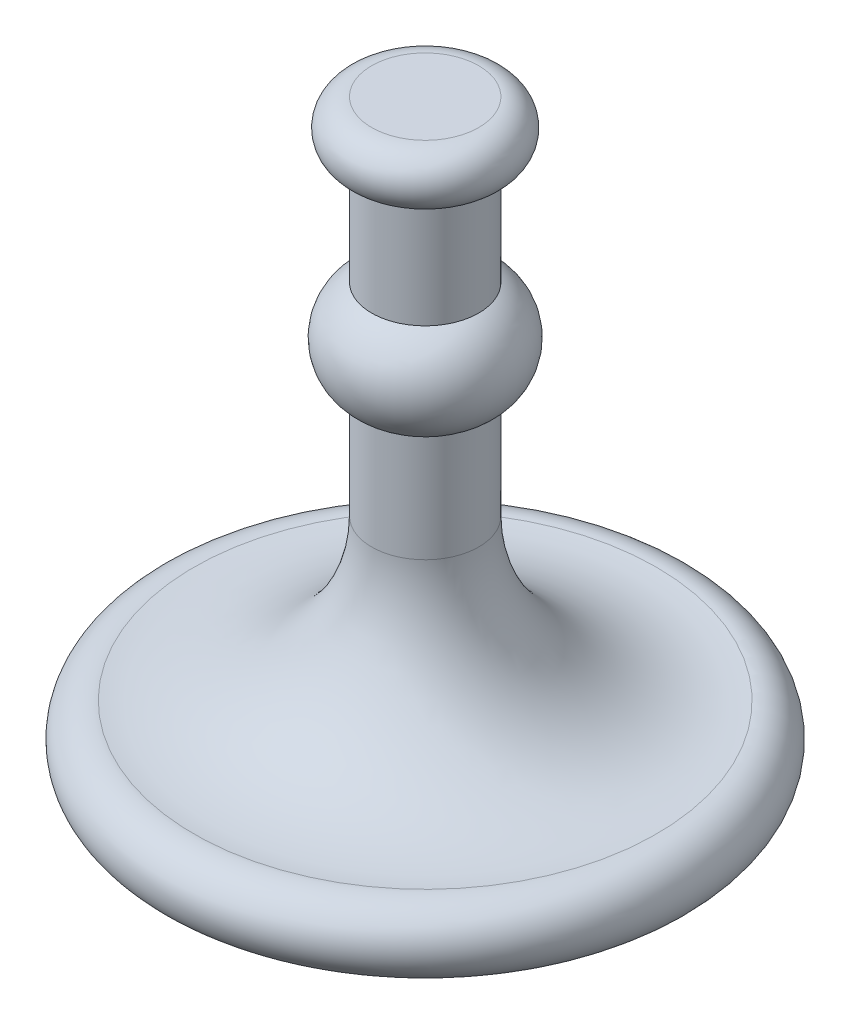
from build123d import *


with BuildPart() as part:
    # Sketch1 → Revolve1 (revolve)
    with BuildSketch(Plane.XY, mode=Mode.PRIVATE) as revolve1_sk:
        with BuildLine():
            Line((0, 0), (0, 220))
            Line((0, 220), (20, 220))
            ThreePointArc((20, 220), (30, 210), (20, 200))
            Line((20, 200), (20, 160))
            ThreePointArc((20, 160), (30.908939581, 142.185606368), (20, 124.371212737))
            Line((20, 124.371212737), (20, 84.371212737))
            ThreePointArc((20, 84.371212737), (39.870136229, 39.766347153), (86.319801124, 24.704973424))
            ThreePointArc((86.319801124, 24.704973424), (100, 14.116257913), (90, 0))
            Line((90, 0), (0, 0))
        make_face()
    revolve(revolve1_sk.sketch.rotate(Axis((0, 0, 0), (0, 1, 0)), 90), axis=Axis((0, 0, 0), (0, 1, 0)))


solid = part.part
